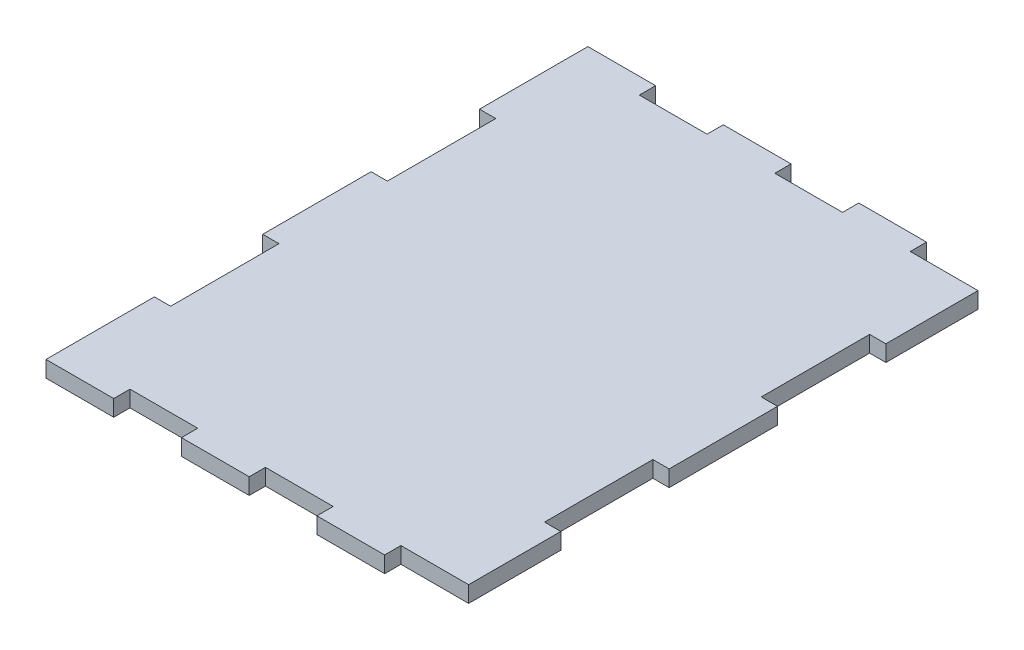
from build123d import *

# Parameters (mm, degrees)
SKETCH1_W           = 150
SKETCH1_H           = 200
BOSS_EXTRUDE1_DEPTH = 6
SKETCH2_W           = 25
SKETCH2_H           = 6
SKETCH2_W_2         = 6
SKETCH2_H_2         = 40
CUT_EXTRUDE1_DEPTH  = 6


with BuildPart() as part:
    # Sketch1 → Boss-Extrude1 (new body)
    with BuildSketch(Plane(origin=(0, 0, 0), x_dir=(1, 0, 0), z_dir=(0, 1, 0))):
        with Locations((75, 100)):
            Rectangle(SKETCH1_W, SKETCH1_H)
    extrude(amount=BOSS_EXTRUDE1_DEPTH)

    # Sketch2 → Cut-Extrude1 (cut)
    with BuildSketch(Plane(origin=(0, 6, 0), x_dir=(1, 0, 0), z_dir=(0, 1, 0))):
        with Locations((37.5, 3)):
            Rectangle(SKETCH2_W, SKETCH2_H)
        with Locations((87.5, 3)):
            Rectangle(SKETCH2_W, SKETCH2_H)
        with Locations((137.5, 3)):
            Rectangle(SKETCH2_W, SKETCH2_H)
        with Locations((37.5, 197)):
            Rectangle(SKETCH2_W, SKETCH2_H)
        with Locations((87.5, 197)):
            Rectangle(SKETCH2_W, SKETCH2_H)
        with Locations((137.5, 197)):
            Rectangle(SKETCH2_W, SKETCH2_H)
        with Locations((3, 140)):
            Rectangle(SKETCH2_W_2, SKETCH2_H_2)
        with Locations((147, 140)):
            Rectangle(SKETCH2_W_2, SKETCH2_H_2)
        with Locations((147, 60)):
            Rectangle(SKETCH2_W_2, SKETCH2_H_2)
        with Locations((3, 60)):
            Rectangle(SKETCH2_W_2, SKETCH2_H_2)
    extrude(amount=-CUT_EXTRUDE1_DEPTH, mode=Mode.SUBTRACT)


solid = part.part
